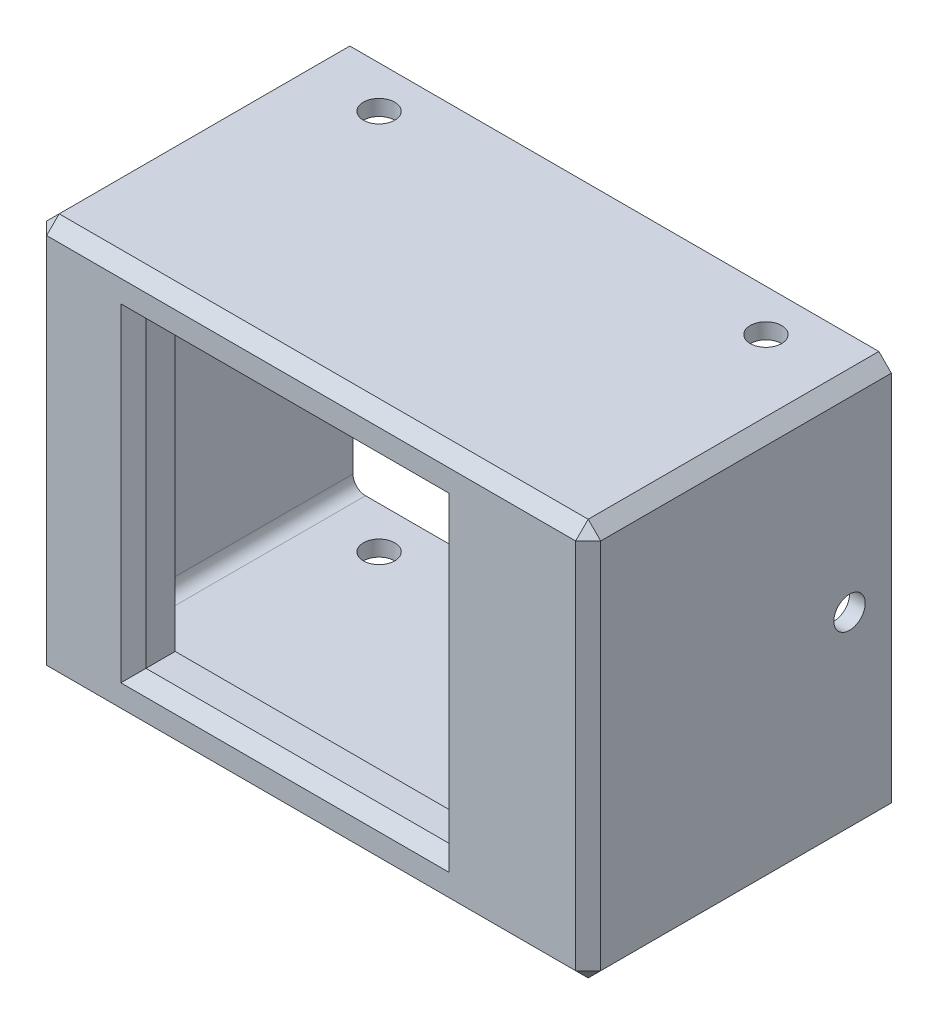
from build123d import *

# Parameters (mm, degrees)
ESQUISSE1_W                  = 53
ESQUISSE1_H                  = 38
BASE_DEPTH                   = 4
ESQUISSE2_W                  = 29
ESQUISSE2_H                  = 29
SCREEN_DEPTH                 = 4
ESQUISSE5_R                  = 2.25
INSERTS_M3_DEPTH             = 3
ESQUISSE6_W                  = 53
ESQUISSE6_H                  = 38
ESQUISSE6_W_2                = 50
ESQUISSE6_H_2                = 35
WALLS_DEPTH                  = 25
CHANFREIN_EXT_SIZE           = 1.2
CONG_1_R                     = 1.2
ESQUISSE7_R                  = 1.5
PASSAGE_VIS_HORIZONTAL_DEPTH = 62.603571325
ESQUISSE9_R                  = 1.5
PASSAGE_VIS_VERTICAL_DEPTH   = 53.642663306


with BuildPart() as part:
    # Esquisse1 → BASE (new body)
    with BuildSketch(Plane.XY):
        Rectangle(ESQUISSE1_W, ESQUISSE1_H)
    extrude(amount=BASE_DEPTH)

    # Esquisse2 → Screen (cut)
    with BuildSketch(Plane.XY.offset(4)):
        with Locations((-2.5, 0)):
            Rectangle(ESQUISSE2_W, ESQUISSE2_H)
    extrude(amount=-SCREEN_DEPTH, mode=Mode.SUBTRACT)

    # Esquisse5 → Inserts_M3 (cut)
    with BuildSketch(Plane(origin=(0, 0, 0), x_dir=(-1, 0, 0), z_dir=(0, 0, -1))):
        with Locations((-21, 13.5)):
            Circle(ESQUISSE5_R)
        with Locations(Location((-21, -13.5, 0), (0, 0, 180))):
            Circle(ESQUISSE5_R)
        with Locations((21, -13.5)):
            Circle(ESQUISSE5_R)
        with Locations(Location((21, 13.5, 0), (0, 0, 180))):
            Circle(ESQUISSE5_R)
    extrude(amount=-INSERTS_M3_DEPTH, mode=Mode.SUBTRACT)

    # Esquisse6 → Walls (add)
    with BuildSketch(Plane(origin=(0, 0, 0), x_dir=(-1, 0, 0), z_dir=(0, 0, -1))):
        Rectangle(ESQUISSE6_W, ESQUISSE6_H)
        Rectangle(ESQUISSE6_W_2, ESQUISSE6_H_2, mode=Mode.SUBTRACT)
    extrude(amount=WALLS_DEPTH)

    # Chanfrein_EXT
    chanfrein_ext_edges = [part.edges().sort_by_distance(p)[0] for p in [
        (26.5, 0, 4),
        (0, 19, 4),
        (-17, 0, 4),
        (-2.5, -14.5, 4),
        (12, 0, 4),
        (-2.5, 14.5, 4),
        (-26.5, 0, 4),
        (-26.5, 19, -10.5),
        (26.5, 19, -10.5),
        (26.5, -19, -10.5),
        (-26.5, -19, -10.5),
        (0, -19, 4),
    ]]
    chamfer(chanfrein_ext_edges, length=CHANFREIN_EXT_SIZE)

    # Congé1
    cong_1_edges = [part.edges().sort_by_distance(p)[0] for p in [
        (0, 17.5, 0),
        (25, 0, 0),
        (0, -17.5, 0),
        (-25, 0, 0),
        (25, 17.5, -12.5),
        (25, -17.5, -12.5),
        (-25, -17.5, -12.5),
        (-25, 17.5, -12.5),
    ]]
    fillet(cong_1_edges, radius=CONG_1_R)

    # Esquisse7 → Passage_Vis_Horizontal (cut, through all)
    with BuildSketch(Plane(origin=(26.5, 0, 0), x_dir=(0, 0, -1), z_dir=(1, 0, 0))):
        with Locations(Location((21, 0, 0), (0, 0, 90))):
            Circle(ESQUISSE7_R)
    extrude(amount=-PASSAGE_VIS_HORIZONTAL_DEPTH, mode=Mode.SUBTRACT)

    # Esquisse9 → Passage_Vis_Vertical (cut, through all)
    with BuildSketch(Plane(origin=(0, 19, 0), x_dir=(1, 0, 0), z_dir=(0, 1, 0))):
        with Locations(Location((-18.5, 21, 0), (0, 0, 180))):
            Circle(ESQUISSE9_R)
        with Locations(Location((18.5, 21, 0), (0, 0, 180))):
            Circle(ESQUISSE9_R)
    extrude(amount=-PASSAGE_VIS_VERTICAL_DEPTH, mode=Mode.SUBTRACT)


solid = part.part
